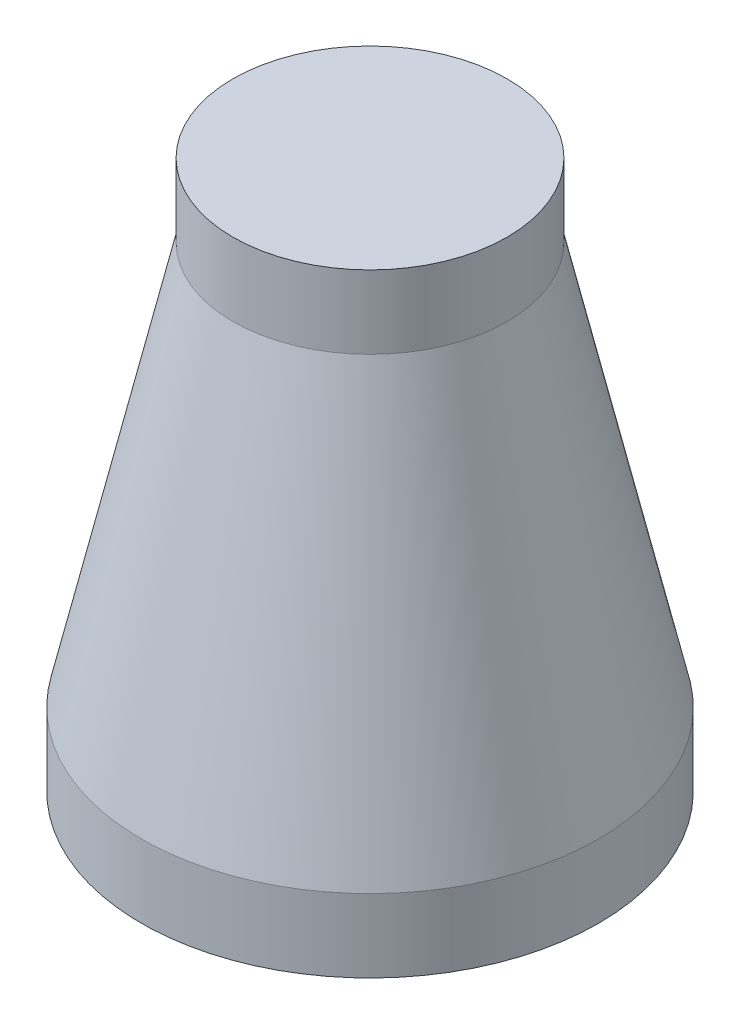
from build123d import *


with BuildPart() as part:
    # 草图1 → 旋转1 (revolve)
    with BuildSketch(Plane.XY, mode=Mode.PRIVATE) as revolve_1_sk:
        Polygon((0, -8), (0, -52), (0, -60), (25, -60), (25, -52), (15, -8), (15, 0), (0, 0), align=None)
    revolve(revolve_1_sk.sketch.rotate(Axis((0, -8, 0), (0, -1, 0)), 180), axis=Axis((0, -8, 0), (0, -1, 0)))


solid = part.part
